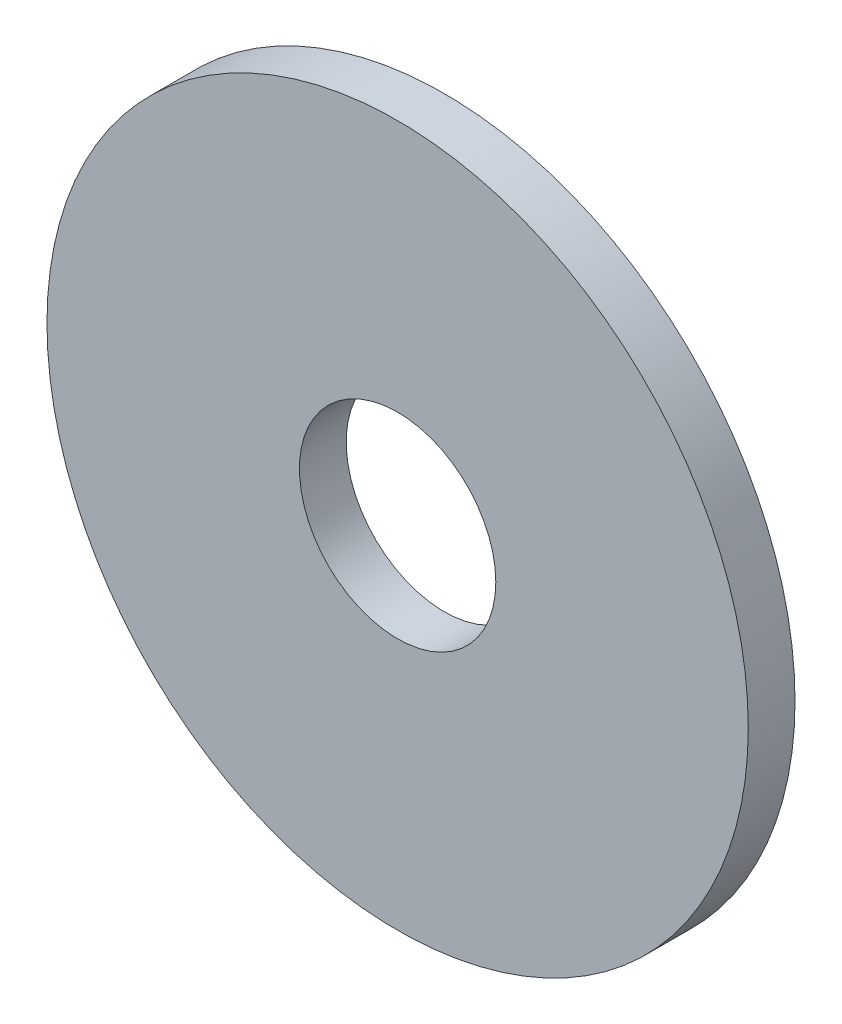
from build123d import *

# Parameters (mm, degrees)
SCHIZZO1_R      = 15
SCHIZZO1_R_2    = 4.2
MAIN_BODY_DEPTH = 1


with BuildPart() as part:
    # Schizzo1 → Main body (new, symmetric)
    with BuildSketch(Plane.XY):
        Circle(SCHIZZO1_R)
        Circle(SCHIZZO1_R_2, mode=Mode.SUBTRACT)
    extrude(amount=MAIN_BODY_DEPTH, both=True)


solid = part.part
